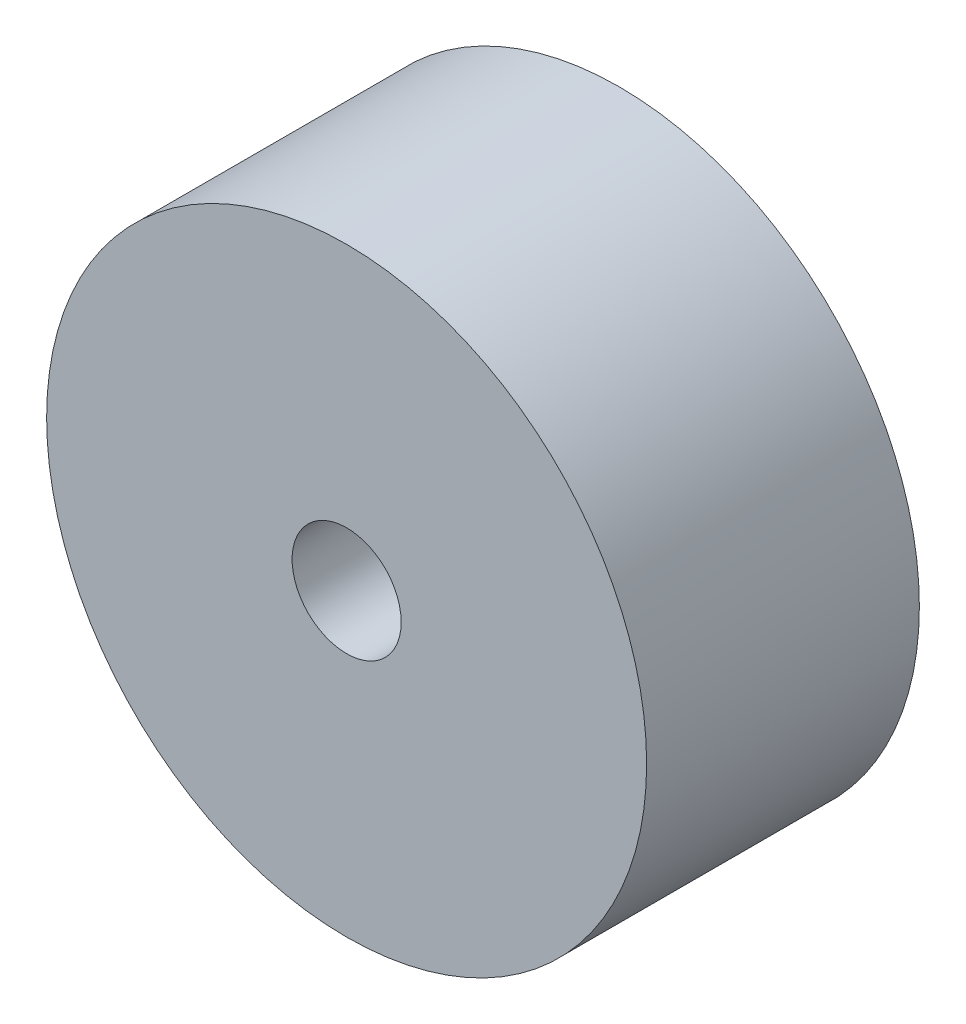
from build123d import *

# Parameters (mm, degrees)
SKETCH1_R           = 27.5
BOSS_EXTRUDE1_DEPTH = 25
SKETCH2_R           = 5
CUT_EXTRUDE1_DEPTH  = 25


with BuildPart() as part:
    # Sketch1 → Boss-Extrude1 (new body)
    with BuildSketch(Plane.XY):
        Circle(SKETCH1_R)
    extrude(amount=BOSS_EXTRUDE1_DEPTH)

    # Sketch2 → Cut-Extrude1 (cut)
    with BuildSketch(Plane.XY.offset(25)):
        Circle(SKETCH2_R)
    extrude(amount=-CUT_EXTRUDE1_DEPTH, mode=Mode.SUBTRACT)


solid = part.part
